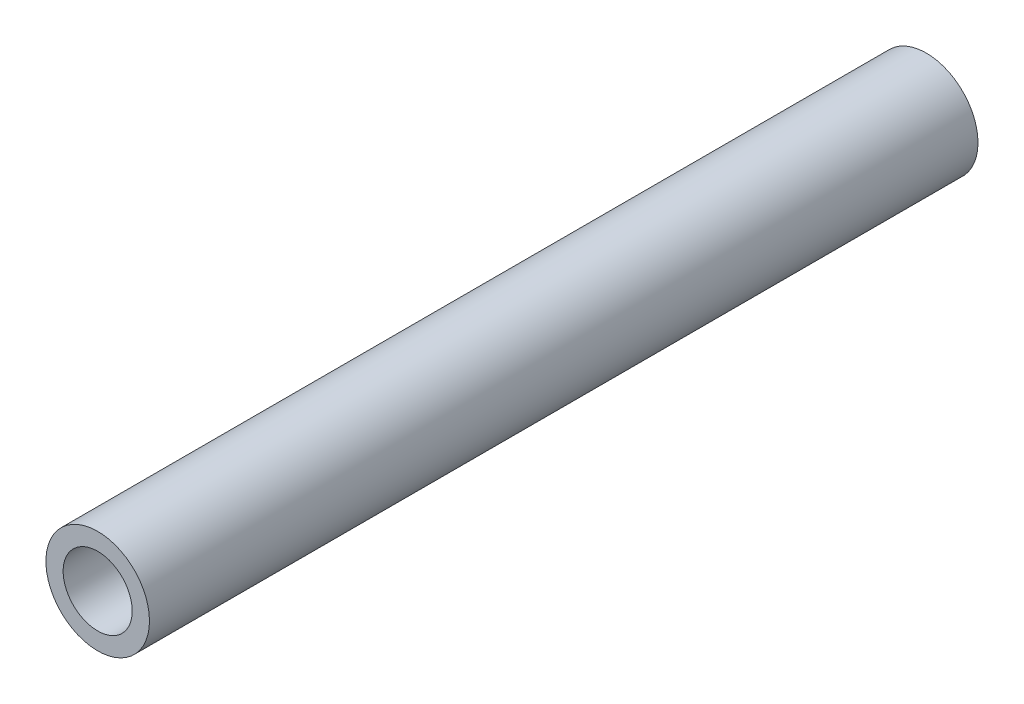
from build123d import *

# Parameters (mm, degrees)
SKETCH1_R           = 6
BOSS_EXTRUDE1_DEPTH = 96
SKETCH2_R           = 4
CUT_EXTRUDE1_DEPTH  = 190


with BuildPart() as part:
    # Sketch1 → Boss-Extrude1 (new body)
    with BuildSketch(Plane.XY):
        Circle(SKETCH1_R)
    extrude(amount=BOSS_EXTRUDE1_DEPTH)

    # Sketch2 → Cut-Extrude1 (cut)
    with BuildSketch(Plane.XY.offset(96)):
        Circle(SKETCH2_R)
    extrude(amount=-CUT_EXTRUDE1_DEPTH, mode=Mode.SUBTRACT)


solid = part.part
